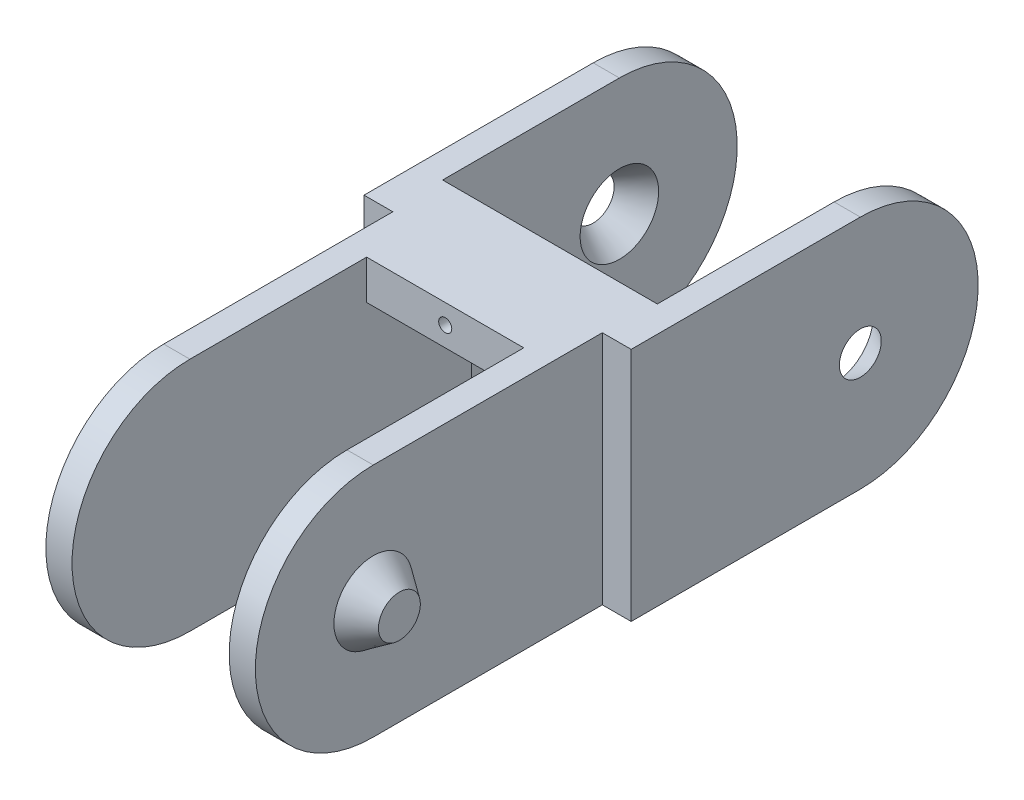
from build123d import *

# Parameters (mm, degrees)
SKETCH1_W               = 16
SKETCH1_H               = 18
SKETCH1_W_2             = 12
SKETCH1_H_2             = 14
EXTRUDE_THIN1_DEPTH     = 4
BOSS_EXTRUDE1_DEPTH     = 2
SKETCH3_R               = 3
BOSS_EXTRUDE2_DEPTH     = 2
BOSS_EXTRUDE2_TAPER     = 35
BOSS_EXTRUDE3_DEPTH     = 2.2
CUT_EXTRUDE4_REACH      = 35.62
SKETCH10_W              = 0.2
SKETCH10_H              = 25.531461486
SKETCH5_R               = 3
CUT_EXTRUDE1_DEPTH      = 2
CUT_EXTRUDE1_DRAFT      = -35
MIRROR3_COPY_1_SKETCH_R = 3
MIRROR3_COPY_1_DEPTH    = 2
MIRROR3_COPY_1_DRAFT    = -35
SKETCH13_W              = 12
SKETCH13_H              = 1
BOSS_EXTRUDE4_DEPTH     = 8
CUT_EXTRUDE5_REACH      = 35.396
SKETCH11_R              = 0.5


with BuildPart() as part:
    # Sketch1 → Extrude-Thin1 (new, symmetric)
    with BuildSketch(Plane.XY):
        Rectangle(SKETCH1_W, SKETCH1_H)
        Rectangle(SKETCH1_W_2, SKETCH1_H_2, mode=Mode.SUBTRACT)
    extrude_thin1 = extrude(amount=EXTRUDE_THIN1_DEPTH, both=True)

    # Sketch2 → Boss-Extrude1 (add)
    with BuildSketch(Plane(origin=(8, 0, 0), x_dir=(0, 0, -1), z_dir=(1, 0, 0))):
        with BuildLine():
            Line((0, 9), (-17.5, 9))
            ThreePointArc((-17.5, 9), (-26.5, 0), (-17.5, -9))
            Line((-17.5, -9), (0, -9))
            Line((0, -9), (0, 9))
        make_face()
    boss_extrude1 = extrude(amount=-BOSS_EXTRUDE1_DEPTH)

    # Sketch3 → Boss-Extrude2 (add)
    with BuildSketch(Plane(origin=(8, 0, 0), x_dir=(0, 0, -1), z_dir=(1, 0, 0))):
        with Locations((-17.5, 0)):
            Circle(SKETCH3_R)
    boss_extrude2 = extrude(amount=BOSS_EXTRUDE2_DEPTH, taper=BOSS_EXTRUDE2_TAPER)

    # Sketch4 → Boss-Extrude3 (add)
    with BuildSketch(Plane(origin=(8, 0, 0), x_dir=(0, 0, -1), z_dir=(1, 0, 0))):
        with BuildLine():
            Line((0, 9), (17.5, 9))
            ThreePointArc((17.5, 9), (26.5, 0), (17.5, -9))
            Line((17.5, -9), (0, -9))
            Line((0, -9), (0, 9))
        make_face()
    boss_extrude3 = extrude(amount=BOSS_EXTRUDE3_DEPTH)

    # Sketch10 → Cut-Extrude4 (cut, up to next)
    with BuildSketch(Plane(origin=(0, 9, 0), x_dir=(1, 0, 0), z_dir=(0, 1, 0)), mode=Mode.PRIVATE) as cut_extrude4_sk1:
        with Locations((8.1, 16.765730743)):
            Rectangle(SKETCH10_W, SKETCH10_H)
    cut_extrude4_tool1 = extrude(cut_extrude4_sk1.sketch, amount=-CUT_EXTRUDE4_REACH, mode=Mode.PRIVATE) & part.part
    cut_extrude4 = cut_extrude4_tool1.solids().sort_by_distance((8.1, 9, -16.765731))[0]
    add(cut_extrude4, mode=Mode.SUBTRACT)


with BuildPart() as cut_extrude1_tool:
    # Sketch5 → Cut-Extrude1 (with draft: the straight prism first)
    with BuildSketch(Plane.ZY.offset(-8.2)):
        with Locations((-17.5, 0)):
            Circle(SKETCH5_R)
    extrude(amount=-CUT_EXTRUDE1_DEPTH)
    # Cut-Extrude1: the draft: its side faces are tilted about the plane it starts from
    cut_extrude1_sides = [cut_extrude1_tool.faces().sort_by_distance(p)[0] for p in [
        (9.2, 0, -20.5),
    ]]
    draft(cut_extrude1_sides, Plane.ZY.offset(-8.2), CUT_EXTRUDE1_DRAFT)


with BuildPart() as part_1:
    add(part.part)

    # Cut-Extrude1: cut by cut_extrude1_tool
    add(cut_extrude1_tool.part, mode=Mode.SUBTRACT)

    # Mirror3: Extrude-Thin1, Boss-Extrude1, Boss-Extrude2, Boss-Extrude3, Cut-Extrude4 across plane
    add(extrude_thin1.mirror(Plane(origin=(0, 0, 0), x_dir=(0, 0, 1), z_dir=(1, 0, 0))))
    add(boss_extrude1.mirror(Plane(origin=(0, 0, 0), x_dir=(0, 0, 1), z_dir=(1, 0, 0))))
    add(boss_extrude2.mirror(Plane(origin=(0, 0, 0), x_dir=(0, 0, 1), z_dir=(1, 0, 0))))
    add(boss_extrude3.mirror(Plane(origin=(0, 0, 0), x_dir=(0, 0, 1), z_dir=(1, 0, 0))))
    add(cut_extrude4.mirror(Plane(origin=(0, 0, 0), x_dir=(0, 0, 1), z_dir=(1, 0, 0))), mode=Mode.SUBTRACT)


with BuildPart() as mirror3_copy_1_tool:
    # Mirror3 copy 1 sketch → Mirror3 copy 1 (with draft: the straight prism first)
    with BuildSketch(Plane(origin=(-8.2, 0, 0), x_dir=(0, 0, 1), z_dir=(1, 0, 0))):
        with Locations((-17.5, 0)):
            Circle(MIRROR3_COPY_1_SKETCH_R)
    extrude(amount=-MIRROR3_COPY_1_DEPTH)
    # Mirror3 copy 1: the draft: its side faces are tilted about the plane it starts from
    mirror3_copy_1_sides = [mirror3_copy_1_tool.faces().sort_by_distance(p)[0] for p in [
        (-9.2, 0, -20.5),
    ]]
    draft(mirror3_copy_1_sides, Plane(origin=(-8.2, 0, 0), x_dir=(0, 0, 1), z_dir=(1, 0, 0)), MIRROR3_COPY_1_DRAFT)


with BuildPart() as part_2:
    add(part_1.part)

    # Mirror3 copy 1: cut by mirror3_copy_1_tool
    add(mirror3_copy_1_tool.part, mode=Mode.SUBTRACT)

    # Sketch13 → Boss-Extrude4 (add)
    with BuildSketch(Plane.XY.offset(4)):
        with Locations((0, 6.5)):
            Rectangle(SKETCH13_W, SKETCH13_H)
    boss_extrude4 = extrude(amount=-BOSS_EXTRUDE4_DEPTH)

    # Mirror5: Boss-Extrude4 across plane
    add(boss_extrude4.mirror(Plane.ZX))

    # Sketch11 → Cut-Extrude5 (cut, up to next)
    with BuildSketch(Plane.XY.offset(4), mode=Mode.PRIVATE) as cut_extrude5_sk1:
        with Locations((0, 7.5)):
            Circle(SKETCH11_R)
    cut_extrude5_tool1 = extrude(cut_extrude5_sk1.sketch, amount=-CUT_EXTRUDE5_REACH, mode=Mode.PRIVATE) & part_2.part
    cut_extrude5 = cut_extrude5_tool1.solids().sort_by_distance((0, 7.5, 4))[0]
    add(cut_extrude5, mode=Mode.SUBTRACT)

    # Mirror4: Cut-Extrude5 across plane
    add(cut_extrude5.mirror(Plane.ZX), mode=Mode.SUBTRACT)


solid = part_2.part
